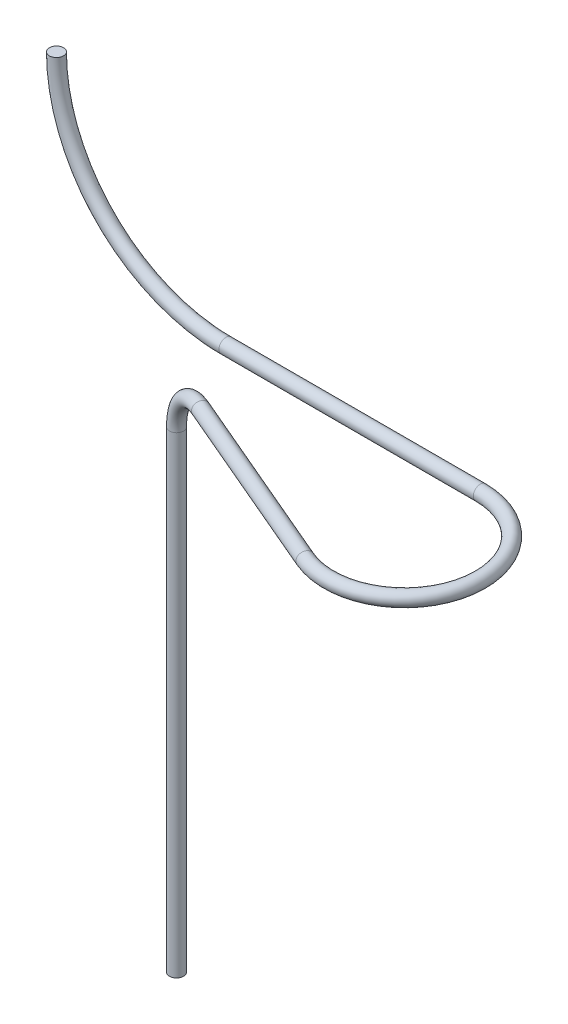
from build123d import *

# Parameters (mm, degrees)
SKETCH6_R = 0.5


with BuildPart() as part:
    # Sweep1: sweep along a curve in space
    with BuildLine() as sweep1_path:
        ThreePointArc((-12, 0, 0), (-8.485281374, -8.485281374, 0), (0, -12, 0))
        Line((0, -12, 0), (18, -12, 0))
        ThreePointArc((18, -12, 0), (23.251188525, -12, 6.434532027), (15.894563339, -12, 10.289171986))
        Line((15.894563339, -12, 10.289171986), (2.988770327, -12, 4.776617378))
        ThreePointArc((2.988770327, -12, 4.776617378), (0.875390561, -12.951902961, 3.873912573), (0, -15.25, 3.5))
        Line((0, -15.25, 3.5), (0, -48.67, 3.5))
    # Sketch6 → Sweep1 (sweep)
    with BuildSketch(Plane(origin=(0, 0, 0), x_dir=(1, 0, 0), z_dir=(0, 1, 0))):
        with Locations((-12, 0)):
            Circle(SKETCH6_R)
    sweep(path=sweep1_path.line)


solid = part.part
